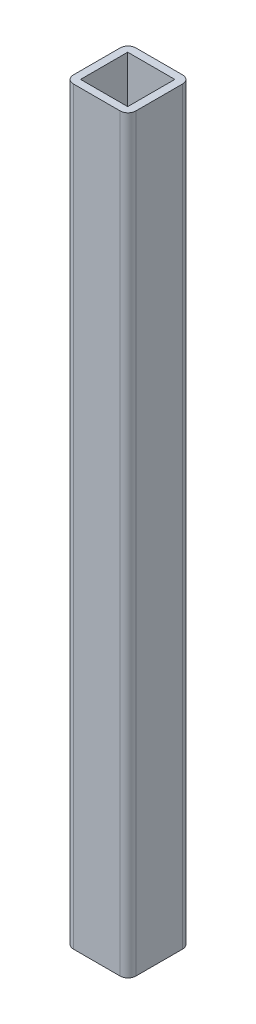
from build123d import *

# Parameters (mm, degrees)
SKETCH1_W      = 38.354
SKETCH1_H      = 38.354
EXTRUDE1_DEPTH = 609.6


with BuildPart() as part:
    # Sketch1 → Extrude1 (new body)
    with BuildSketch(Plane(origin=(0, 0, 0), x_dir=(1, 0, 0), z_dir=(0, 1, 0))):
        with BuildLine():
            Line((-19.05, -25.4), (19.05, -25.4))
            ThreePointArc((19.05, -25.4), (23.540128061, -23.540128061), (25.4, -19.05))
            Line((25.4, -19.05), (25.4, 19.05))
            ThreePointArc((25.4, 19.05), (23.540128061, 23.540128061), (19.05, 25.4))
            Line((19.05, 25.4), (-19.05, 25.4))
            ThreePointArc((-19.05, 25.4), (-23.540128061, 23.540128061), (-25.4, 19.05))
            Line((-25.4, 19.05), (-25.4, -19.05))
            ThreePointArc((-25.4, -19.05), (-23.540128061, -23.540128061), (-19.05, -25.4))
        make_face()
        with Locations((-0.127, -0.127)):
            Rectangle(SKETCH1_W, SKETCH1_H, mode=Mode.SUBTRACT)
    extrude(amount=EXTRUDE1_DEPTH)


solid = part.part
